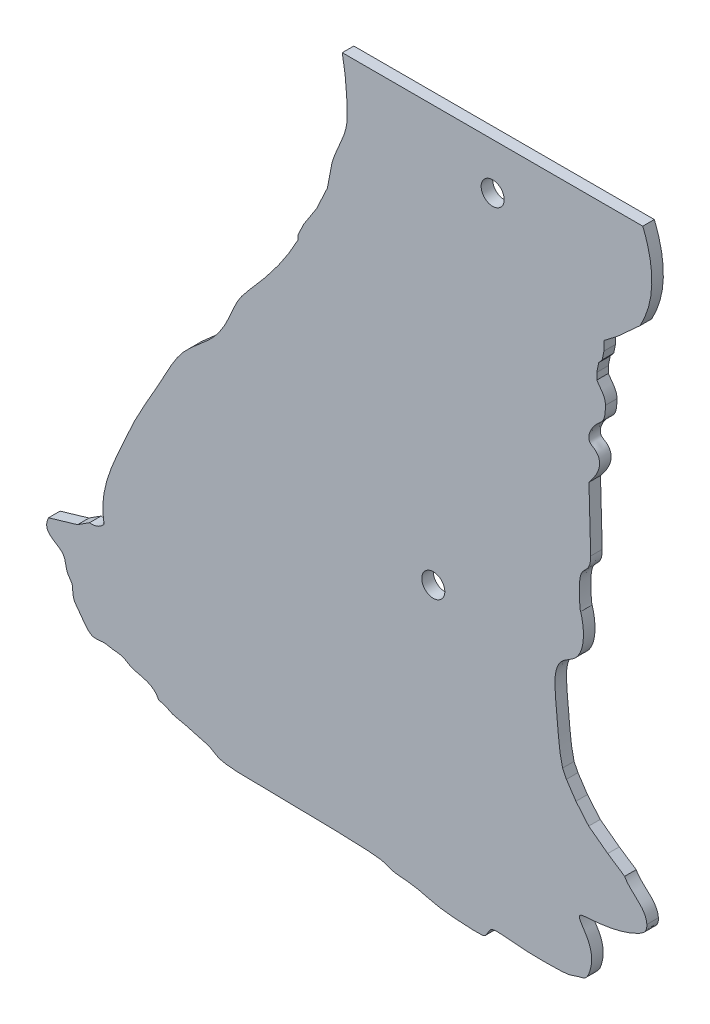
from build123d import *

# Parameters (mm, degrees)
SKETCH1_R           = 3.174288046
SKETCH1_R_2         = 3.174288
BOSS_EXTRUDE2_DEPTH = 3.175


with BuildPart() as part:
    # Sketch1 → Boss-Extrude2 (new body)
    with BuildSketch(Plane.XY):
        with BuildLine():
            Line((167.202192931, 42.201207676), (162.551708352, 45.309526764))
            Line((162.551708352, 45.309526764), (157.314695785, 49.223337881))
            Line((157.314695785, 49.223337881), (153.792941224, 53.393644073))
            Line((153.792941224, 53.393644073), (151.178747268, 57.312700692))
            Line((151.178747268, 57.312700692), (150.112611404, 59.463302564))
            add(Edge.make_bspline(
                [(150.112611404, 59.463302564), (148.956776361, 63.836980097), (148.948583694, 71.439405876), (146.850507307, 84.051422667), (156.469353715, 88.150203705), (156.247504434, 95.51023866), (155.085269681, 99.2555556)],
                knots=[0, 0, 0, 0, 0.30878338, 0.618237109, 0.70440559, 1, 1, 1, 1], degree=3))
            add(Edge.make_bspline(
                [(157.85398611, 113.880538491), (157.856396998, 113.869859914), (157.850620297, 110.688002063), (155.308060719, 109.384630599), (154.418838948, 105.053269567), (154.8695522, 99.483416676), (155.085269681, 99.2555556)],
                knots=[0, 0, 0, 0, 0.124798805, 0.365607846, 0.555267038, 1, 1, 1, 1], degree=3))
            Line((157.85398611, 113.880538491), (157.37548461, 131.229540091))
            add(Edge.make_bspline(
                [(161.892659898, 151.807216677), (161.91251897, 149.031337188), (161.449944322, 147.791607901), (158.445100345, 145.385958906), (156.130886371, 141.380315264), (158.830222147, 140.043511959), (161.648730322, 137.407909117), (159.459654716, 133.727674066), (157.37548461, 131.229540091)],
                knots=[0, 0, 0, 0, 0.190659477, 0.228612673, 0.488802546, 0.534056192, 0.585175937, 1, 1, 1, 1], degree=3))
            add(Edge.make_bspline(
                [(159.534362736, 156.659486678), (160.786697559, 154.839870961), (162.005548182, 153.612430632), (161.892659898, 151.807216677)],
                knots=[0, 0, 0, 0, 1, 1, 1, 1], degree=3))
            Line((159.534362736, 156.659486678), (159.534362736, 158.498026385))
            Line((159.534362736, 158.498026385), (160.082455849, 161.112276627))
            Line((160.082455849, 161.112276627), (161.024283069, 162.24246929))
            Line((161.024283069, 162.24246929), (161.51276424, 164.572387305))
            Line((161.51276424, 164.572387305), (161.51276424, 167.102297744))
            Line((161.51276424, 167.102297744), (165.183542032, 169.901250177))
            Line((165.183542032, 169.901250177), (171.472031107, 175.621746691))
            add(Edge.make_bspline(
                [(172.196352762, 199.687728108), (177.512545782, 186.611864968), (171.472031107, 175.621746691)],
                knots=[0, 0, 0, 1, 1, 1], degree=2))
            Line((172.196352762, 199.687728108), (89.47301913, 199.687728108))
            add(Edge.make_bspline(
                [(89.47301913, 199.687728108), (90.449698127, 194.83749072), (90.825955315, 189.837761557), (90.838257386, 180.280743918), (87.678298822, 176.191377166), (86.590775441, 171.767770411)],
                knots=[0, 0, 0, 0, 0.517811069, 0.520823107, 1, 1, 1, 1], degree=3))
            Line((86.590775441, 171.767770411), (85.388246292, 165.381063893))
            Line((85.388246292, 165.381063893), (82.402306125, 158.982620678))
            Line((82.402306125, 158.982620678), (78.826589302, 153.432528352))
            Line((78.826589302, 153.432528352), (77.30963174, 150.181905003))
            Line((77.30963174, 150.181905003), (77.30963174, 148.972997238))
            add(Edge.make_bspline(
                [(23.904060298, 54.499744977), (22.54196001, 62.044422938), (27.151157223, 71.719882884), (33.171565612, 85.673583344), (39.470341202, 95.744406946), (45.044436084, 107.397118431), (54.154773918, 113.07293548), (58.357878564, 120.674742163), (60.641830631, 126.791490456), (68.416588167, 135.274765788), (73.920776574, 142.489426767), (77.30963174, 148.972997238)],
                knots=[0, 0, 0, 0, 0.194457475, 0.285904466, 0.412663627, 0.517827397, 0.629268786, 0.691338637, 0.750377013, 0.804905464, 1, 1, 1, 1], degree=3))
            add(Edge.make_bspline(
                [(19.90471503, 52.852955749), (22.437142387, 52.608313662), (23.904060298, 54.499744977)],
                knots=[0, 0, 0, 1, 1, 1], degree=2))
            Line((19.90471503, 52.852955749), (16.611136574, 50.735655313))
            Line((16.611136574, 50.735655313), (8.612446038, 48.383099273))
            add(Edge.make_bspline(
                [(8.612446038, 48.383099273), (6.569110394, 43.962826835), (13.647787757, 43.729648821), (13.25353988, 37.991488936), (15.22587651, 36.112808324), (15.244510931, 34.207409749), (15.425694449, 32.409220236), (16.98119857, 30.317149701), (18.454955258, 28.208570124), (20.727276999, 25.608877763), (23.640354073, 26.519579017), (26.378802415, 25.704997487), (29.007712932, 25.794951803), (31.225977748, 24.007852384), (34.946801718, 23.349304233), (38.00066538, 22.222153794), (38.883062856, 20.144990847)],
                knots=[0, 0, 0, 0, 0.185719976, 0.273851295, 0.320038418, 0.350192261, 0.393849297, 0.435550567, 0.514834292, 0.569194905, 0.638873602, 0.687586559, 0.755837415, 0.80106818, 0.86555143, 1, 1, 1, 1], degree=3))
            add(Edge.make_bspline(
                [(38.883062856, 20.144990847), (41.287485761, 19.565633761), (42.345781106, 18.507338416), (45.419877108, 18.154573301), (49.753848521, 16.793907858), (52.777549507, 16.18916766), (54.793350164, 14.828502217), (56.355595674, 14.173367003), (60.135221906, 13.770206872), (61.546282366, 13.770206872), (99.241754657, 13.215861691), (101.285601848, 12.223202762), (103.959367113, 11.297668631), (106.324621001, 11.297668631), (111.569314404, 10.577808752), (115.168613799, 9.24092612), (123.909769472, 8.521066241), (128.023254495, 8.521066241), (128.948788625, 8.726740492), (129.97715988, 10.783483004), (131.005531136, 11.811854259), (139.335338307, 10.783483004), (144.785705962, 10.783483004), (151.984304751, 10.783483004), (154.349558639, 12.120365636), (156.714812527, 12.120365636), (158.154532285, 16.028176407), (158.154532285, 19.318964425), (157.331835281, 21.684218313), (156.40630115, 23.329612322), (153.732535886, 27.134585968), (157.318908473, 27.134585968), (163.062883757, 27.775503981), (167.439245879, 28.924299038), (170.393290311, 30.100446358), (172.444710055, 31.285711099), (173.20373536, 32.322817748), (173.319982479, 33.191252106), (173.319982479, 33.793001898)],
                knots=[0, 0, 0, 0, 0.028571429, 0.057142857, 0.085714286, 0.114285714, 0.142857143, 0.171428571, 0.2, 0.228571429, 0.257142857, 0.285714286, 0.314285714, 0.342857143, 0.371428571, 0.4, 0.428571429, 0.457142857, 0.485714286, 0.514285714, 0.542857143, 0.571428571, 0.6, 0.628571429, 0.657142857, 0.685714286, 0.714285714, 0.742857143, 0.771428571, 0.8, 0.828571429, 0.857142857, 0.885714286, 0.914285714, 0.942857143, 0.971428571, 0.985714286, 1, 1, 1, 1], degree=3))
            add(Edge.make_bspline(
                [(173.319982479, 33.793001898), (173.056351571, 37.626592871), (168.840626644, 39.112234918), (167.202192931, 42.201207676)],
                knots=[0, 0, 0, 0, 1, 1, 1, 1], degree=3))
        make_face()
        with Locations((130.872154182, 186.924213923)):
            Circle(SKETCH1_R, mode=Mode.SUBTRACT)
        with Locations((114.527567577, 85.315873367)):
            Circle(SKETCH1_R_2, mode=Mode.SUBTRACT)
    extrude(amount=BOSS_EXTRUDE2_DEPTH)


solid = part.part
